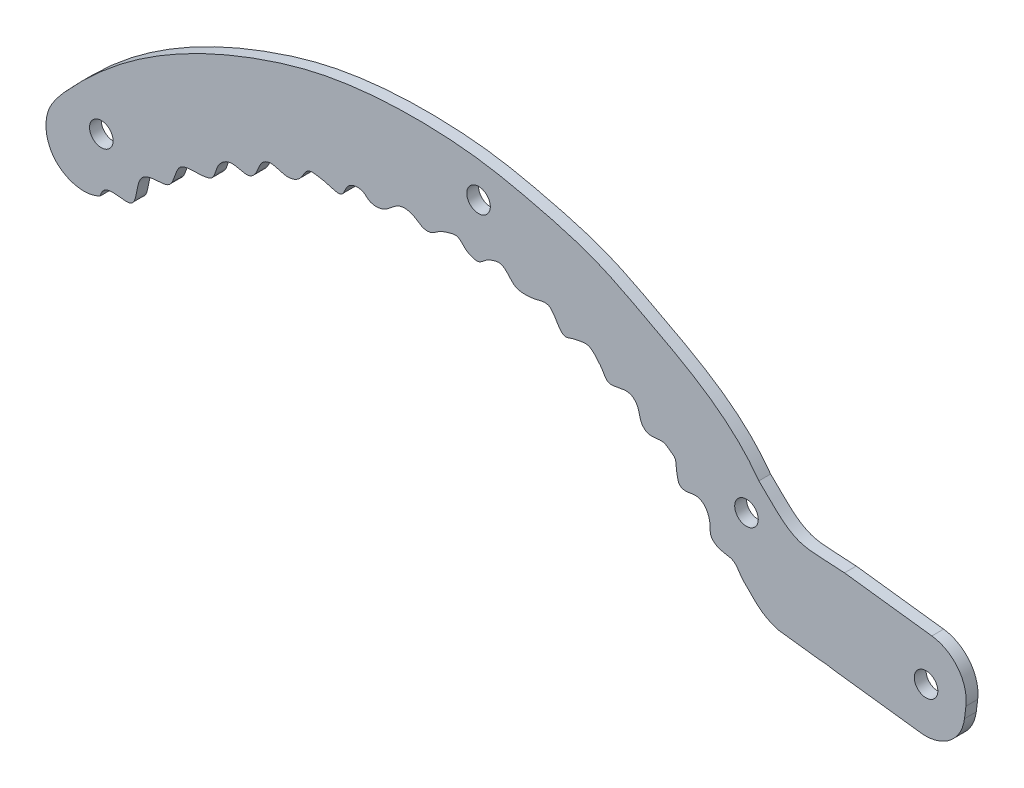
from build123d import *

# Parameters (mm, degrees)
SKETCH_1_R      = 1.5
EXTRUDE_1_DEPTH = 1.5


with BuildPart() as part:
    # 草图1 → 凸台-拉伸1 (new body)
    with BuildSketch(Plane.XY):
        with BuildLine():
            Line((-0.520900423, -5.545888964), (-11.402805529, -4.184291743))
            add(Edge.make_bspline(
                [(-13.703961558, -3.89635984), (-12.933600427, -3.947035944), (-12.16672614, -4.021536567), (-11.402805529, -4.184291743)],
                knots=[0.407976376, 0.407976376, 0.407976376, 0.407976376, 0.440424775, 0.440424775, 0.440424775, 0.440424775], degree=3))
            Line((-13.703961558, -3.89635984), (-18.741314261, -3.266061618))
            add(Edge.make_bspline(
                [(-35.659392475, 10.352812393), (-34.939498551, 9.69165786), (-33.515364228, 10.578504641), (-32.468734044, 9.579425708), (-31.70587848, 9.174291378), (-31.692770623, 8.120228444), (-31.534935304, 7.276338328), (-31.31133933, 6.340903611), (-30.309270109, 6.016783424), (-29.355980674, 6.427789527), (-28.233661215, 6.059354049), (-27.575138976, 5.148928128), (-27.284831057, 4.019068184), (-27.402830996, 2.901008002), (-26.724491723, 2.143540757), (-25.699040703, 1.739884825), (-24.144109396, 1.696842551), (-23.504516931, 0.303214671), (-22.317893288, -0.867353105), (-21.139941781, -2.160995658), (-19.678701401, -2.94530162), (-18.927926575, -3.207860453), (-18.741314261, -3.266061618)],
                knots=[0, 0, 0, 0, 0.036097754, 0.047992692, 0.058181774, 0.069734768, 0.087708592, 0.096698401, 0.107023851, 0.126400839, 0.138602891, 0.153227265, 0.171393147, 0.187122158, 0.197485969, 0.211171774, 0.233173167, 0.256561051, 0.268556148, 0.303731538, 0.328871743, 0.337069791, 0.337069791, 0.337069791, 0.337069791], degree=3))
            add(Edge.make_bspline(
                [(-47.403001965, 17.376020885), (-47.0506307, 17.153358683), (-46.342389637, 15.070431843), (-44.961478824, 15.796937639), (-44.079955846, 15.885554639), (-43.201927757, 16.163418929), (-42.379752994, 15.78728864), (-41.708749666, 15.040889011), (-41.033296055, 14.265701114), (-40.409710498, 12.940136148), (-38.858689541, 13.359022109), (-37.399124521, 13.518169211), (-36.193330386, 12.1204189), (-36.362186705, 10.879753219), (-35.659392475, 10.352812393)],
                knots=[0, 0, 0, 0, 0.161236225, 0.212348344, 0.265446348, 0.336192936, 0.378687986, 0.430636784, 0.526782428, 0.58317029, 0.682556587, 0.781270878, 0.853713789, 1, 1, 1, 1], degree=3))
            add(Edge.make_bspline(
                [(-71.207384467, 18.375427075), (-70.561391868, 17.670981975), (-68.631576336, 17.728274317), (-67.414354878, 19.356691053), (-65.893100389, 19.541333475), (-64.829861394, 19.077997991), (-63.900461357, 18.3417094), (-62.735642484, 18.376265098), (-61.913779787, 19.160134581), (-60.796504779, 19.509350123), (-59.452394815, 19.947995233), (-58.662109626, 18.866206791), (-57.801495643, 18.367891852), (-56.722577671, 18.09707571), (-55.975993866, 18.942815518), (-55.048310829, 19.327248221), (-53.988598491, 19.603487743), (-53.036958597, 18.781737949), (-52.257241397, 17.70136579), (-50.76741944, 17.561904603), (-49.170248046, 17.76582458), (-47.922011476, 18.264060776), (-47.403001965, 17.376020885)],
                knots=[0, 0, 0, 0, 0.101433113, 0.182304189, 0.213922123, 0.268056796, 0.309965909, 0.34593792, 0.389140378, 0.432998877, 0.482664358, 0.529097115, 0.56671955, 0.598853252, 0.644172777, 0.680167064, 0.715860802, 0.759457234, 0.81099574, 0.863337515, 0.916048189, 1, 1, 1, 1], degree=3))
            add(Edge.make_bspline(
                [(-105.034557463, 1.419048763), (-104.537224229, 3.556691586), (-99.915724907, 0.726117709), (-100.686268224, 6.335705103), (-97.991937437, 6.763178945), (-95.611958933, 6.788293571), (-95.506292601, 10.302247265), (-92.685825494, 10.041085087), (-90.47139797, 10.347151335), (-90.285716652, 12.331808489), (-88.720551352, 13.636794927), (-87.196726971, 13.201524016), (-85.973040848, 13.003714755), (-84.976094544, 13.969442191), (-84.792932236, 15.273476469), (-83.275525106, 16.167903652), (-82.01213745, 15.473379202), (-80.58834959, 15.429157786), (-79.32840524, 16.064966203), (-78.816979747, 17.671586261), (-77.077705557, 17.47240223), (-75.892588834, 17.193262703), (-74.076772999, 16.583433208), (-73.660426729, 18.88418954), (-71.827544211, 18.93645502), (-71.207384467, 18.375427075)],
                knots=[0, 0, 0, 0, 0.100331873, 0.186040252, 0.234954161, 0.270300487, 0.337741822, 0.40191981, 0.438279808, 0.476829941, 0.523229195, 0.559516768, 0.58417291, 0.604077361, 0.648703103, 0.670042471, 0.715950186, 0.738312734, 0.768610762, 0.808997733, 0.834826144, 0.87587524, 0.906400305, 0.9417144, 1, 1, 1, 1], degree=3))
            add(Edge.make_bspline(
                [(-21.130845116, 11.933561412), (-24.860902591, 17.162928468), (-32.164252682, 20.893740938), (-42.137002015, 26.216593397), (-49.045205504, 28.055662941), (-55.803526642, 29.535441398), (-61.948602147, 30.104802239), (-69.529110192, 30.108290935), (-77.072940239, 29.091744184), (-83.884291665, 27.029870129), (-91.408872233, 24.170883779), (-100.536470974, 19.260537032), (-107.722268555, 12.866432049), (-111.964208693, 7.875125786), (-112.038713313, 4.670975852), (-110.388332642, 1.235617841), (-106.988725941, 0.36084251), (-105.034557463, 1.419048763)],
                knots=[0, 0, 0, 0, 0.162308773, 0.214040795, 0.297345888, 0.349154488, 0.396314503, 0.459530434, 0.548645129, 0.595484357, 0.646703325, 0.76081959, 0.864658636, 0.902713076, 0.926128156, 0.944546812, 1, 1, 1, 1], degree=3))
            add(Edge.make_bspline(
                [(-10.228021871, 7.242569771), (-10.911856094, 7.280996311), (-12.835129239, 7.45598324), (-17.157981253, 7.413204488), (-19.651209566, 10.616249428), (-21.130845116, 11.933561412)],
                knots=[0.763961689, 0.763961689, 0.763961689, 0.763961689, 0.803221292, 0.875531472, 1, 1, 1, 1], degree=3))
            Line((-10.228021871, 7.242569771), (0.904953592, 5.849557399))
            ThreePointArc((0.904953592, 5.849557399), (4.231308359, 3.957462026), (5.245482903, 0.267460544))
            Line((5.245482903, 0.267460544), (5.061196432, -1.205359653))
            ThreePointArc((5.061196432, -1.205359653), (3.169101059, -4.53171442), (-0.520900423, -5.545888964))
        make_face()
        with Locations((-104.906076677, 8.3115684)):
            Circle(SKETCH_1_R, mode=Mode.SUBTRACT)
        with Locations((-22.709339509, 7.634159424)):
            Circle(SKETCH_1_R, mode=Mode.SUBTRACT)
        with Locations((0.167304743, 0.145501946)):
            Circle(SKETCH_1_R, mode=Mode.SUBTRACT)
        with Locations((-56.847164613, 25.072525588)):
            Circle(SKETCH_1_R, mode=Mode.SUBTRACT)
    extrude(amount=EXTRUDE_1_DEPTH)


solid = part.part
